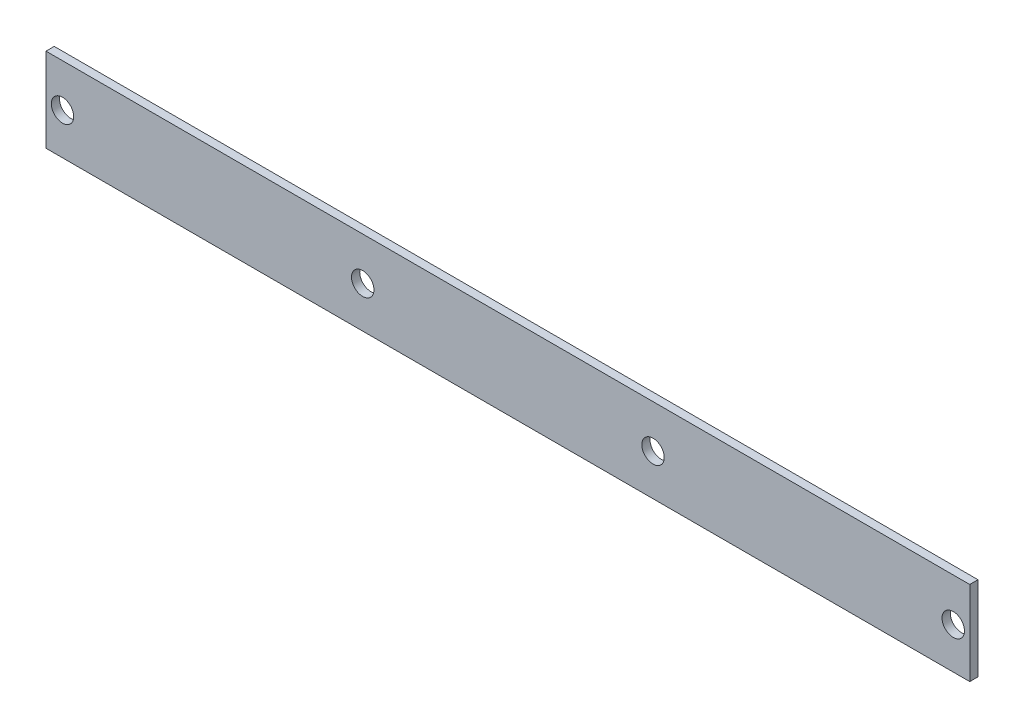
from build123d import *

# Parameters (mm, degrees)
SKETCH1_W           = 280
SKETCH1_H           = 25.5
SKETCH1_R           = 3.4
BOSS_EXTRUDE1_DEPTH = 2.5


with BuildPart() as part:
    # Sketch1 → Boss-Extrude1 (new body)
    with BuildSketch(Plane.XY):
        with Locations((0, 0.25)):
            Rectangle(SKETCH1_W, SKETCH1_H)
        with Locations((135, 0)):
            Circle(SKETCH1_R, mode=Mode.SUBTRACT)
        with Locations((44, 0)):
            Circle(SKETCH1_R, mode=Mode.SUBTRACT)
        with Locations(Location((-135, 0, 0), (0, 0, 180))):
            Circle(SKETCH1_R, mode=Mode.SUBTRACT)
        with Locations(Location((-44, 0, 0), (0, 0, 180))):
            Circle(SKETCH1_R, mode=Mode.SUBTRACT)
    extrude(amount=BOSS_EXTRUDE1_DEPTH)


solid = part.part
